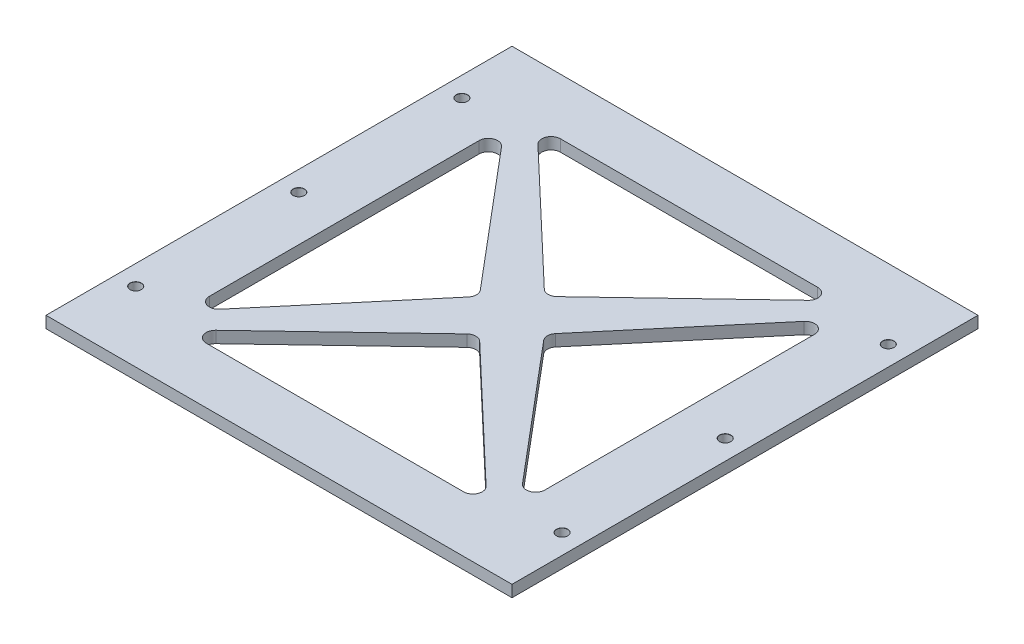
from build123d import *

# Parameters (mm, degrees)
SKETCH2_W                      = 100
SKETCH2_H                      = 100
BOSS_EXTRUDE1_DEPTH            = 2.5
M2_CLEARANCE_HOLE1_D           = 2.4
M2_CLEARANCE_HOLE1_CSINK_D     = 2.45
M2_CLEARANCE_HOLE1_CSINK_ANGLE = 90
LPATTERN1_COUNT                = 3
LPATTERN1_PITCH                = 35
MIRROR1_COPY_1_D               = 2.4
MIRROR1_COPY_1_CSINK_D         = 2.45
MIRROR1_COPY_1_CSINK_ANGLE     = 90
MIRROR1_COPY_2_D               = 2.4
MIRROR1_COPY_2_CSINK_D         = 2.45
MIRROR1_COPY_2_CSINK_ANGLE     = 90
CUT_EXTRUDE1_DEPTH             = 2.5


with BuildPart() as part:
    # Sketch2 → Boss-Extrude1 (new body)
    with BuildSketch(Plane(origin=(0, 0, 0), x_dir=(1, 0, 0), z_dir=(0, 1, 0))):
        Rectangle(SKETCH2_W, SKETCH2_H)
    extrude(amount=BOSS_EXTRUDE1_DEPTH)

    # M2 Clearance Hole1 (through all)
    with Locations(Plane(origin=(0, 2.5, 0), x_dir=(1, 0, 0), z_dir=(0, 1, 0))):
        with Locations((-45.75, 35)):
            m2_clearance_hole1 = CounterSinkHole(M2_CLEARANCE_HOLE1_D / 2, M2_CLEARANCE_HOLE1_CSINK_D / 2, counter_sink_angle=M2_CLEARANCE_HOLE1_CSINK_ANGLE)

    # LPattern1: M2 Clearance Hole1 ×3
    with Locations(*[(0, 0, i * LPATTERN1_PITCH) for i in range(1, LPATTERN1_COUNT)]):
        add(m2_clearance_hole1, mode=Mode.SUBTRACT)

    # Mirror1: M2 Clearance Hole1 across plane
    add(m2_clearance_hole1.mirror(Plane(origin=(0, 0, 0), x_dir=(0, 0, 1), z_dir=(1, 0, 0))), mode=Mode.SUBTRACT)

    # Mirror1 copy 1 (through all)
    with Locations(Plane(origin=(0, 2.5, 35), x_dir=(-1, 0, 0), z_dir=(0, 1, 0))):
        with Locations((-45.75, -35)):
            CounterSinkHole(MIRROR1_COPY_1_D / 2, MIRROR1_COPY_1_CSINK_D / 2, counter_sink_angle=MIRROR1_COPY_1_CSINK_ANGLE)

    # Mirror1 copy 2 (through all)
    with Locations(Plane(origin=(0, 2.5, 70), x_dir=(-1, 0, 0), z_dir=(0, 1, 0))):
        with Locations((-45.75, -35)):
            CounterSinkHole(MIRROR1_COPY_2_D / 2, MIRROR1_COPY_2_CSINK_D / 2, counter_sink_angle=MIRROR1_COPY_2_CSINK_ANGLE)

    # Sketch5 → Cut-Extrude1 (cut)
    with BuildSketch(Plane(origin=(0, 2.5, 0), x_dir=(1, 0, 0), z_dir=(0, 1, 0))):
        with BuildLine():
            Line((1.377777778, 8.309393123), (28.989112389, 34.550266095))
            ThreePointArc((28.989112389, 34.550266095), (29.468680542, 36.741799228), (27.611334612, 38))
            Line((27.611334612, 38), (-27.611334612, 38))
            ThreePointArc((-27.611334612, 38), (-29.468680542, 36.741799228), (-28.989112389, 34.550266095))
            Line((-28.989112389, 34.550266095), (-1.377777778, 8.309393123))
            ThreePointArc((-1.377777778, 8.309393123), (0, 7.759127028), (1.377777778, 8.309393123))
        make_face()
        with BuildLine():
            Line((27.611334612, -38), (-27.611334612, -38))
            ThreePointArc((-27.611334612, -38), (-29.468680542, -36.741799228), (-28.989112389, -34.550266095))
            Line((-28.989112389, -34.550266095), (-1.377777778, -8.309393123))
            ThreePointArc((-1.377777778, -8.309393123), (0, -7.759127028), (1.377777778, -8.309393123))
            Line((1.377777778, -8.309393123), (28.989112389, -34.550266095))
            ThreePointArc((28.989112389, -34.550266095), (29.468680542, -36.741799228), (27.611334612, -38))
        make_face()
        with BuildLine():
            Line((-36, 28.932797546), (-36, -28.932797546))
            ThreePointArc((-36, -28.932797546), (-34.686074143, -30.811441278), (-32.47069773, -30.221686435))
            Line((-32.47069773, -30.221686435), (-8.086269602, -1.288888889))
            ThreePointArc((-8.086269602, -1.288888889), (-7.615571872, 0), (-8.086269602, 1.288888889))
            Line((-8.086269602, 1.288888889), (-32.47069773, 30.221686435))
            ThreePointArc((-32.47069773, 30.221686435), (-34.686074143, 30.811441278), (-36, 28.932797546))
        make_face()
        with BuildLine():
            Line((32.47069773, -30.221686435), (8.086269602, -1.288888889))
            ThreePointArc((8.086269602, -1.288888889), (7.615571872, 0), (8.086269602, 1.288888889))
            Line((8.086269602, 1.288888889), (32.47069773, 30.221686435))
            ThreePointArc((32.47069773, 30.221686435), (34.686074143, 30.811441278), (36, 28.932797546))
            Line((36, 28.932797546), (36, -28.932797546))
            ThreePointArc((36, -28.932797546), (34.686074143, -30.811441278), (32.47069773, -30.221686435))
        make_face()
    extrude(amount=-CUT_EXTRUDE1_DEPTH, mode=Mode.SUBTRACT)


solid = part.part
